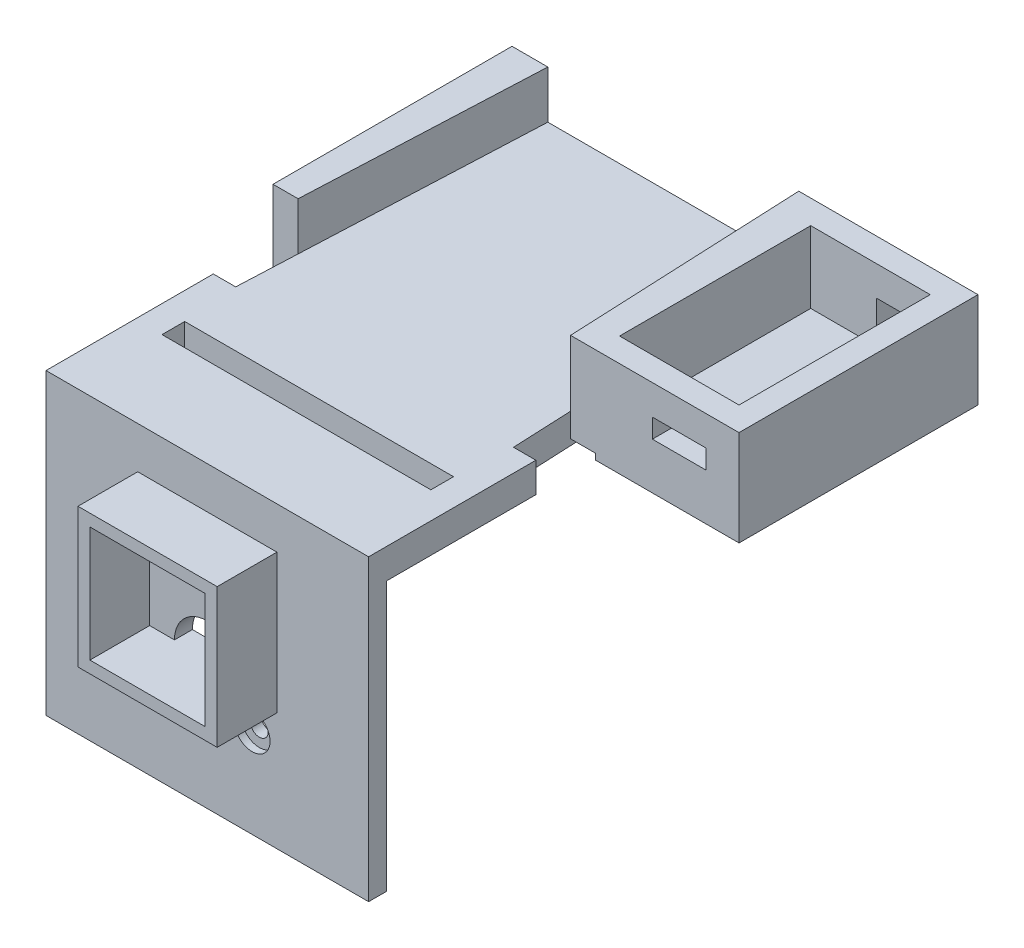
from build123d import *

# Parameters (mm, degrees)
CROQUIS1_W                   = 54
CROQUIS1_H                   = 70
CROQUIS1_R                   = 1.5
SALIENTE_EXTRUIR1_DEPTH      = 3
CROQUIS2_R                   = 3
CORTAR_EXTRUIR1_DEPTH        = 1.2
CROQUIS3_W                   = 23.3
CROQUIS3_H                   = 23.3
CROQUIS3_W_2                 = 19.3
CROQUIS3_H_2                 = 19.3
SALIENTE_EXTRUIR2_DEPTH      = 10
CROQUIS4_W                   = 54
CROQUIS4_H                   = 5
SALIENTE_EXTRUIR3_DEPTH      = 75
CROQUIS6_W                   = 54
CROQUIS6_H                   = 20
CORTAR_EXTRUIR2_DEPTH        = 3
CORTAR_EXTRUIR4_DEPTH        = 5
CROQUIS8_W                   = 45
CROQUIS8_H                   = 3.8
CORTAR_EXTRUIR5_DEPTH        = 5
CROQUIS9_W                   = 10.5
CROQUIS9_H                   = 3.7
CORTAR_EXTRUIR6_DEPTH        = 3
SALIENTE_EXTRUIR4_DEPTH      = 8
SALIENTE_EXTRUIR4_DEPTH_BACK = 4
SALIENTE_EXTRUIR5_DEPTH      = 20
CROQUIS12_W                  = 9
CROQUIS12_H                  = 7
CORTAR_EXTRUIR7_DEPTH        = 4
CROQUIS13_W                  = 40
CROQUIS13_H                  = 13
SALIENTE_EXTRUIR6_DEPTH      = 4
CROQUIS16_W                  = 9
CROQUIS16_H                  = 3.2
CORTAR_EXTRUIR9_DEPTH        = 4
CROQUIS17_W                  = 20
CROQUIS17_H                  = 32
SALIENTE_EXTRUIR7_DEPTH      = 3


with BuildPart() as part:
    # Croquis1 → Saliente-Extruir1 (new body)
    with BuildSketch(Plane.XY):
        Rectangle(CROQUIS1_W, CROQUIS1_H)
        with Locations((-7.5, 0)):
            Circle(CROQUIS1_R, mode=Mode.SUBTRACT)
        with Locations(Location((7.5, 0, 0), (0, 0, 180))):
            Circle(CROQUIS1_R, mode=Mode.SUBTRACT)
    extrude(amount=SALIENTE_EXTRUIR1_DEPTH)

    # Croquis2 → Cortar-Extruir1 (cut)
    with BuildSketch(Plane.XY.offset(3)):
        with Locations((-7.5, 0)):
            Circle(CROQUIS2_R)
        with Locations(Location((7.5, 0, 0), (0, 0, 180))):
            Circle(CROQUIS2_R)
    extrude(amount=-CORTAR_EXTRUIR1_DEPTH, mode=Mode.SUBTRACT)

    # Croquis3 → Saliente-Extruir2 (add)
    with BuildSketch(Plane.XY.offset(3)):
        with Locations((0, 16.35)):
            Rectangle(CROQUIS3_W, CROQUIS3_H)
        with Locations((0, 16.35)):
            Rectangle(CROQUIS3_W_2, CROQUIS3_H_2, mode=Mode.SUBTRACT)
    extrude(amount=SALIENTE_EXTRUIR2_DEPTH)

    # Croquis4 → Saliente-Extruir3 (add)
    with BuildSketch(Plane(origin=(0, 0, 0), x_dir=(-1, 0, 0), z_dir=(0, 0, -1))):
        with Locations((0, 32.5)):
            Rectangle(CROQUIS4_W, CROQUIS4_H)
    extrude(amount=SALIENTE_EXTRUIR3_DEPTH)

    # Croquis6 → Cortar-Extruir2 (cut)
    with BuildSketch(Plane(origin=(0, 0, 0), x_dir=(-1, 0, 0), z_dir=(0, 0, -1))):
        with Locations((0, -25)):
            Rectangle(CROQUIS6_W, CROQUIS6_H)
    extrude(amount=-CORTAR_EXTRUIR2_DEPTH, mode=Mode.SUBTRACT)

    # Croquis7 → Cortar-Extruir4 (cut)
    with BuildSketch(Plane(origin=(0, 35, 0), x_dir=(1, 0, 0), z_dir=(0, 1, 0))):
        Polygon((-27, 75), (-21, 75), (-23.25, 25), (-27, 25), align=None)
        Polygon((23.25, 25), (27, 25), (27, 75), (21, 75), align=None)
    extrude(amount=-CORTAR_EXTRUIR4_DEPTH, mode=Mode.SUBTRACT)

    # Croquis8 → Cortar-Extruir5 (cut)
    with BuildSketch(Plane(origin=(0, 35, 0), x_dir=(1, 0, 0), z_dir=(0, 1, 0))):
        with Locations((0, 13.816893204)):
            Rectangle(CROQUIS8_W, CROQUIS8_H)
    extrude(amount=-CORTAR_EXTRUIR5_DEPTH, mode=Mode.SUBTRACT)

    # Croquis9 → Cortar-Extruir6 (cut)
    with BuildSketch(Plane.XY.offset(3)):
        with Locations((4.4, 24.15)):
            Rectangle(CROQUIS9_W, CROQUIS9_H)
        with BuildLine():
            Line((5.5, 6.7), (-5.5, 6.7))
            ThreePointArc((-5.5, 6.7), (0, 12.2), (5.5, 6.7))
        make_face()
    extrude(amount=-CORTAR_EXTRUIR6_DEPTH, mode=Mode.SUBTRACT)

    # Croquis10 → Saliente-Extruir4 (add, two sides: drawn at the far end of the back side and taken through both)
    with BuildSketch(Plane(origin=(0, 35, 0), x_dir=(1, 0, 0), z_dir=(0, 1, 0)).offset(-SALIENTE_EXTRUIR4_DEPTH_BACK)):
        Polygon((-21, 75), (-27, 75), (-27, 35), (-22.8, 35), align=None)
        Polygon((27, 35), (22.8, 35), (21, 75), (27, 75), align=None)
    extrude(amount=SALIENTE_EXTRUIR4_DEPTH + SALIENTE_EXTRUIR4_DEPTH_BACK)

    # Croquis11 → Saliente-Extruir5 (add)
    with BuildSketch(Plane(origin=(27, 0, 0), x_dir=(0, 0, -1), z_dir=(1, 0, 0))):
        Polygon((35, 43), (39, 43), (39, 34), (71, 34), (71, 43), (75, 43), (75, 30), (35, 30), align=None)
    extrude(amount=SALIENTE_EXTRUIR5_DEPTH)

    # Croquis12 → Cortar-Extruir7 (cut)
    with BuildSketch(Plane(origin=(0, 0, -75), x_dir=(-1, 0, 0), z_dir=(0, 0, -1))):
        with Locations((-42.5, 37.5)):
            Rectangle(CROQUIS12_W, CROQUIS12_H)
    extrude(amount=-CORTAR_EXTRUIR7_DEPTH, mode=Mode.SUBTRACT)

    # Croquis13 → Saliente-Extruir6 (add)
    with BuildSketch(Plane(origin=(47, 0, 0), x_dir=(0, 0, -1), z_dir=(1, 0, 0))):
        with Locations((55, 36.5)):
            Rectangle(CROQUIS13_W, CROQUIS13_H)
    extrude(amount=SALIENTE_EXTRUIR6_DEPTH)

    # Croquis16 → Cortar-Extruir9 (cut)
    with BuildSketch(Plane.XY.offset(-35)):
        with Locations((41, 39.4)):
            Rectangle(CROQUIS16_W, CROQUIS16_H)
    extrude(amount=-CORTAR_EXTRUIR9_DEPTH, mode=Mode.SUBTRACT)

    # Croquis17 → Saliente-Extruir7 (add)
    with BuildSketch(Plane(origin=(0, 43, 0), x_dir=(1, 0, 0), z_dir=(0, 1, 0))):
        Polygon((21, 75), (51, 75), (51, 35), (22.8, 35), align=None)
        with Locations((37, 55)):
            Rectangle(CROQUIS17_W, CROQUIS17_H, mode=Mode.SUBTRACT)
    extrude(amount=SALIENTE_EXTRUIR7_DEPTH)


solid = part.part
